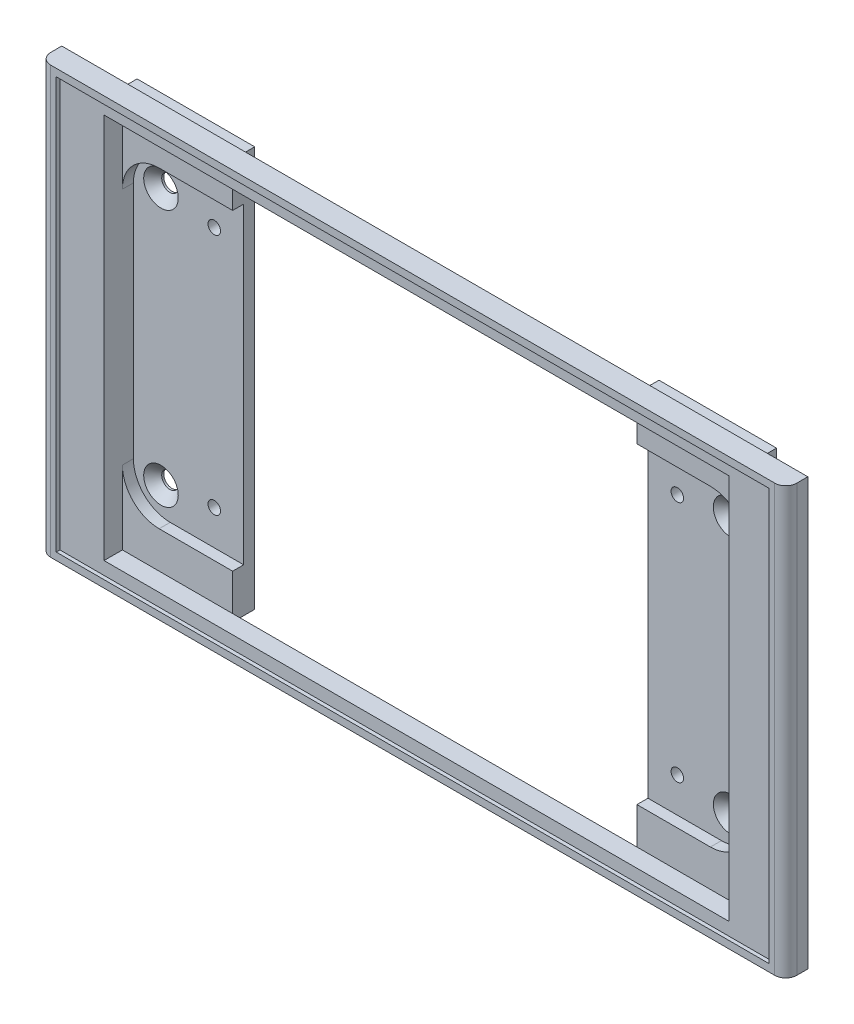
from build123d import *

# Parameters (mm, degrees)
ESBO_O1_W                                    = 203
ESBO_O1_H                                    = 116
RESSALTO_EXTRUS_O1_DEPTH                     = 6
ESBO_O2_W                                    = 194
ESBO_O2_H                                    = 112
CORTE_EXTRUS_O1_DEPTH                        = 1
FILETE2_R                                    = 3
ESBO_O3_W                                    = 174
ESBO_O3_H                                    = 109
RESSALTO_EXTRUS_O2_DEPTH                     = 11
ESBO_O4_W                                    = 110
ESBO_O4_H                                    = 109
CORTE_EXTRUS_O2_DEPTH                        = 6
ESBO_O5_W                                    = 170
ESBO_O5_H                                    = 105
CORTE_EXTRUS_O3_DEPTH                        = 8
FURO_COM_FOLGA_DE_M31_D                      = 3.4
ESCAREADO_PARA_PARAFUSO_COM_CABE_A_E_2_COUNT = 2
ESCAREADO_PARA_PARAFUSO_COM_CABE_A_E_2_PITCH = 155
ESCAREADO_PARA_PARAFUSO_COM_CABE_A_E_3_COUNT = 2
ESCAREADO_PARA_PARAFUSO_COM_CABE_A_E_3_PITCH = 70
ESCAREADO_PARA_PARAFUSO_COM_CABE_A_E_4_COUNT = 2
ESCAREADO_PARA_PARAFUSO_COM_CABE_A_E_4_PITCH = 170.073513517
ESBO_O10_W                                   = 30
ESBO_O10_H                                   = 10
RESSALTO_EXTRUS_O3_DEPTH                     = 3
FILETE3_R                                    = 10


with BuildPart() as part:
    # Esboço1 → Ressalto-extrusão1 (new body)
    with BuildSketch(Plane.XY):
        Rectangle(ESBO_O1_W, ESBO_O1_H)
    extrude(amount=RESSALTO_EXTRUS_O1_DEPTH)

    # Esboço2 → Corte-extrusão1 (cut)
    with BuildSketch(Plane.XY.offset(6)):
        Rectangle(ESBO_O2_W, ESBO_O2_H)
    extrude(amount=-CORTE_EXTRUS_O1_DEPTH, mode=Mode.SUBTRACT)

    # Filete2
    filete2_edges = [part.edges().sort_by_distance(p)[0] for p in [
        (-101.5, 0, 6),
        (101.5, 0, 6),
    ]]
    fillet(filete2_edges, radius=FILETE2_R)

    # Esboço3 → Ressalto-extrusão2 (add)
    with BuildSketch(Plane(origin=(0, 0, 5), x_dir=(-1, 0, 0), z_dir=(0, 0, -1))):
        Rectangle(ESBO_O3_W, ESBO_O3_H)
    extrude(amount=RESSALTO_EXTRUS_O2_DEPTH)

    # Esboço4 → Corte-extrusão2 (cut)
    with BuildSketch(Plane(origin=(0, 0, -6), x_dir=(-1, 0, 0), z_dir=(0, 0, -1))):
        Rectangle(ESBO_O4_W, ESBO_O4_H)
    extrude(amount=-CORTE_EXTRUS_O2_DEPTH, mode=Mode.SUBTRACT)

    # Esboço5 → Corte-extrusão3 (cut)
    with BuildSketch(Plane.XY.offset(5)):
        Rectangle(ESBO_O5_W, ESBO_O5_H)
    extrude(amount=-CORTE_EXTRUS_O3_DEPTH, mode=Mode.SUBTRACT)

    # Furo com folga de M31 (through all)
    with Locations(Plane(origin=(0, 0, -6), x_dir=(-1, 0, 0), z_dir=(0, 0, -1))):
        with Locations((-63, 33), (63, 33), (63, -33), (-63, -33)):
            Hole(FURO_COM_FOLGA_DE_M31_D / 2)

    # Esboço9 → Escareado para parafuso com cabeça escareada chata de M41 (revolve, cut)
    with BuildSketch(Plane(origin=(77.5, 35, -3), x_dir=(0, -1, 0), z_dir=(1, 0, 0))):
        Polygon((0, 0), (0, 3), (2.25, 3), (2.25, 2.45), (4.7, 0), align=None)
    escareado_para_parafuso_com_cabe_a_escar = revolve(axis=Axis((77.5, 35, 3.35), (0, 0, -1)), mode=Mode.SUBTRACT)

    # Escareado para parafuso com cabe_a e 2: Escareado para parafuso com cabeça escareada chata de M41 ×2
    with Locations(*[(-i * ESCAREADO_PARA_PARAFUSO_COM_CABE_A_E_2_PITCH, 0, 0) for i in range(1, ESCAREADO_PARA_PARAFUSO_COM_CABE_A_E_2_COUNT)]):
        add(escareado_para_parafuso_com_cabe_a_escar, mode=Mode.SUBTRACT)

    # Escareado para parafuso com cabe_a e 3: Escareado para parafuso com cabeça escareada chata de M41 ×2
    with Locations(*[(0, -i * ESCAREADO_PARA_PARAFUSO_COM_CABE_A_E_3_PITCH, 0) for i in range(1, ESCAREADO_PARA_PARAFUSO_COM_CABE_A_E_3_COUNT)]):
        add(escareado_para_parafuso_com_cabe_a_escar, mode=Mode.SUBTRACT)

    # Escareado para parafuso com cabe_a e 4: Escareado para parafuso com cabeça escareada chata de M41 ×2
    with Locations(*[Vector(-0.911370599658675, -0.41158672242649835, 0) * (i * ESCAREADO_PARA_PARAFUSO_COM_CABE_A_E_4_PITCH) for i in range(1, ESCAREADO_PARA_PARAFUSO_COM_CABE_A_E_4_COUNT)]):
        add(escareado_para_parafuso_com_cabe_a_escar, mode=Mode.SUBTRACT)

    # Esboço10 → Ressalto-extrusão3 (add)
    with BuildSketch(Plane.XY.offset(-3)):
        with Locations((-70, 47.5)):
            Rectangle(ESBO_O10_W, ESBO_O10_H)
        with Locations((70, 47.5)):
            Rectangle(ESBO_O10_W, ESBO_O10_H)
        with Locations((70, -47.5)):
            Rectangle(ESBO_O10_W, ESBO_O10_H)
        with Locations((-70, -47.5)):
            Rectangle(ESBO_O10_W, ESBO_O10_H)
    extrude(amount=RESSALTO_EXTRUS_O3_DEPTH)

    # Filete3
    filete3_edges = [part.edges().sort_by_distance(p)[0] for p in [
        (-85, 42.5, -1.5),
        (85, 42.5, -1.5),
        (85, -42.5, -1.5),
        (-85, -42.5, -1.5),
    ]]
    fillet(filete3_edges, radius=FILETE3_R)


solid = part.part
